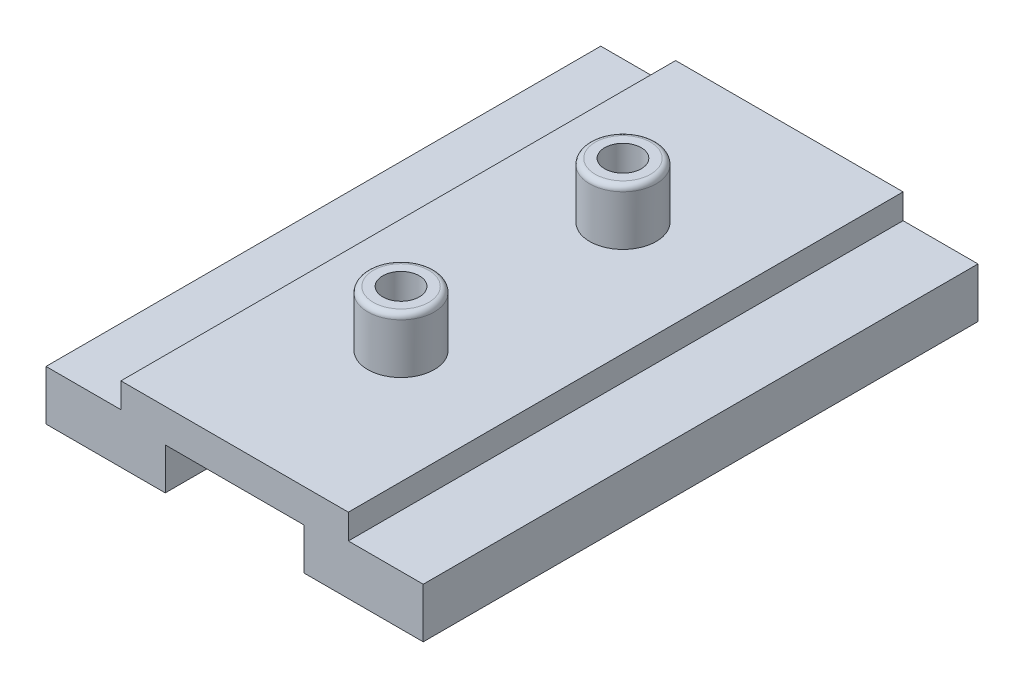
from build123d import *

# Parameters (mm, degrees)
BOSS_EXTRUDE1_DEPTH   = 50
SKETCH4_R             = 3
BOSS_EXTRUDE2_DEPTH   = 5
M4X0_7_TAPPED_HOLE1_D = 3.3
FILLET1_R             = 0.5


with BuildPart() as part:
    # Sketch1 → Boss-Extrude1 (new body)
    with BuildSketch(Plane.XY):
        Polygon((0, 0), (0, 4.5), (6.75, 4.5), (6.75, 6.75), (27.25, 6.75), (27.25, 4.5), (34, 4.5), (34, 0), (23.25, 0), (23.25, 3.75), (10.75, 3.75), (10.75, 0), align=None)
    extrude(amount=BOSS_EXTRUDE1_DEPTH)

    # Sketch4 → Boss-Extrude2 (add)
    with BuildSketch(Plane(origin=(0, 6.75, 0), x_dir=(1, 0, 0), z_dir=(0, 1, 0))):
        with Locations(Location((17, -15, 0), (0, 0, 90))):
            Circle(SKETCH4_R)
        with Locations(Location((17, -35, 0), (0, 0, 90))):
            Circle(SKETCH4_R)
    extrude(amount=BOSS_EXTRUDE2_DEPTH)

    # M4x0.7 Tapped Hole1 (through all)
    with Locations(Plane(origin=(17, 11.75, 15), x_dir=(0, 0, 1), z_dir=(0, 1, 0))):
        with Locations((0, 0), (20, 0)):
            Hole(M4X0_7_TAPPED_HOLE1_D / 2)

    # Fillet1
    fillet1_edges = [part.edges().sort_by_distance(p)[0] for p in [
        (17, 11.75, 18),
        (17, 11.75, 38),
    ]]
    fillet(fillet1_edges, radius=FILLET1_R)


solid = part.part
